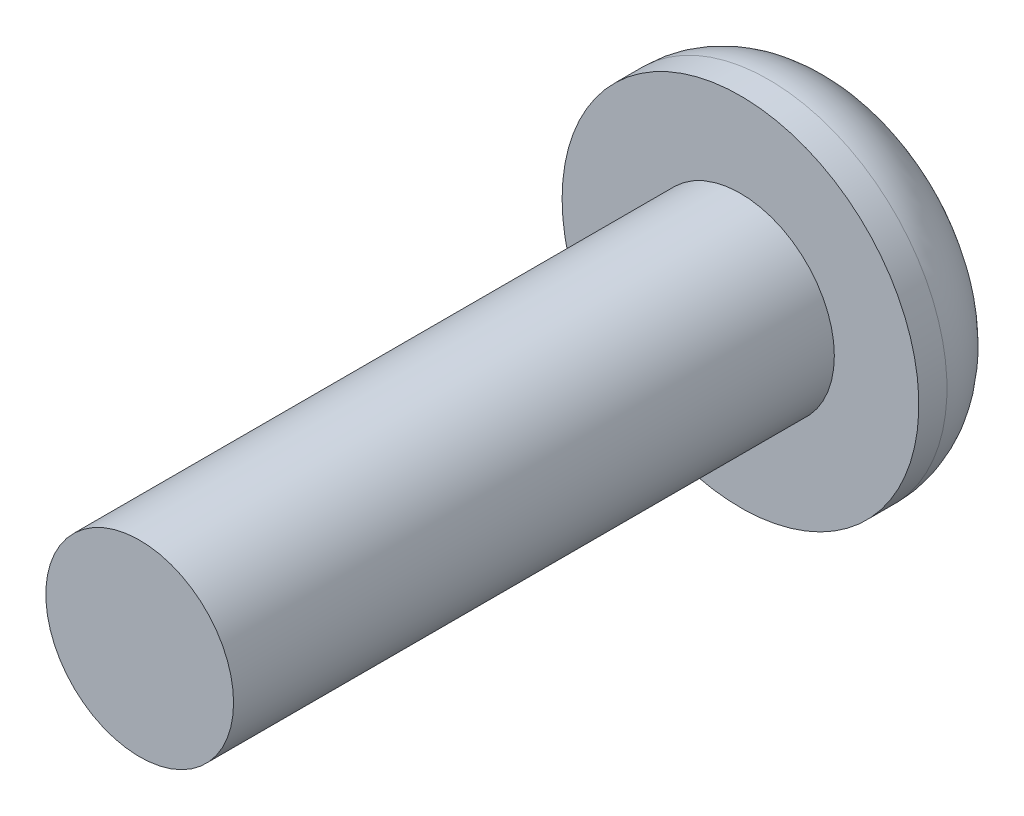
from build123d import *

# Parameters (mm, degrees)
SKETCH_1_R      = 2.5
EXTRUDE_1_DEPTH = 16
SKETCH_2_R      = 4.75
EXTRUDE_2_DEPTH = 2.75
FILLET_1_R      = 2


with BuildPart() as part:
    # 草图1 → 凸台-拉伸1 (new body)
    with BuildSketch(Plane.XY):
        Circle(SKETCH_1_R)
    extrude(amount=EXTRUDE_1_DEPTH)

    # 草图2 → 凸台-拉伸2 (add)
    with BuildSketch(Plane(origin=(0, 0, 0), x_dir=(-1, 0, 0), z_dir=(0, 0, -1))):
        Circle(SKETCH_2_R)
    extrude(amount=EXTRUDE_2_DEPTH)

    # 圆角1
    fillet_1_edges = [part.edges().sort_by_distance(p)[0] for p in [
        (4.75, 0, -2.75),
    ]]
    fillet(fillet_1_edges, radius=FILLET_1_R)


solid = part.part
